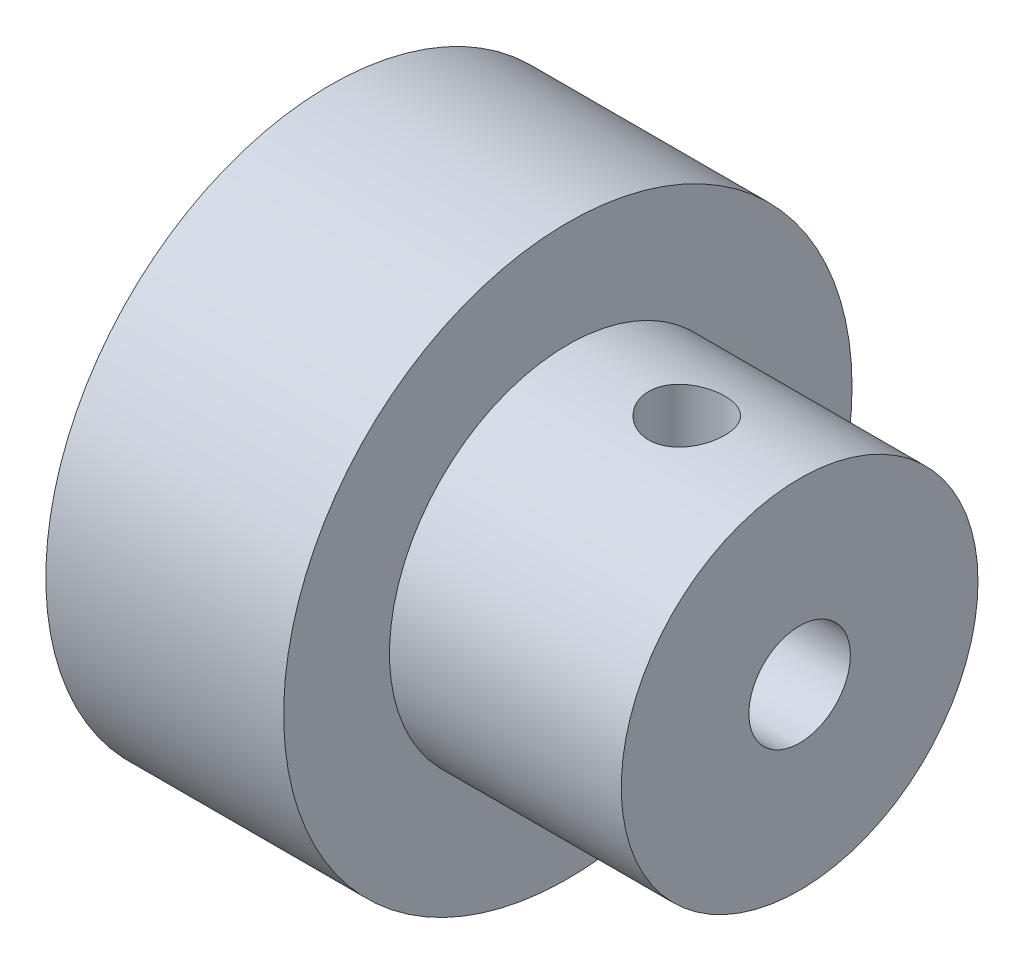
from build123d import *

# Parameters (mm, degrees)
CUT_EXTRUDE1_DEPTH      = 20.334926531
CUT_EXTRUDE1_DEPTH_BACK = 20.334926531
SKETCH2_R               = 1.190625


with BuildPart() as part:
    # Sketch1 → Revolve1 (revolve)
    with BuildSketch(Plane.XY):
        Polygon((0, 1.5875), (0, 5.5794077), (-7.250077802, 5.5794077), (-7.250077802, 8.89), (-14.689288069, 8.89), (-14.689288069, 1.5875), align=None)
    revolve(axis=Axis((0, 0, 0), (-1, 0, 0)))

    # Sketch2 → Cut-Extrude1 (cut, two sides: drawn at the far end of the back side and taken through both)
    with BuildSketch(Plane(origin=(0, 0, 0), x_dir=(1, 0, 0), z_dir=(0, 1, 0)).offset(-CUT_EXTRUDE1_DEPTH_BACK)):
        with Locations((-3.529556327, 0)):
            Circle(SKETCH2_R)
    extrude(amount=CUT_EXTRUDE1_DEPTH + CUT_EXTRUDE1_DEPTH_BACK, mode=Mode.SUBTRACT)


solid = part.part
